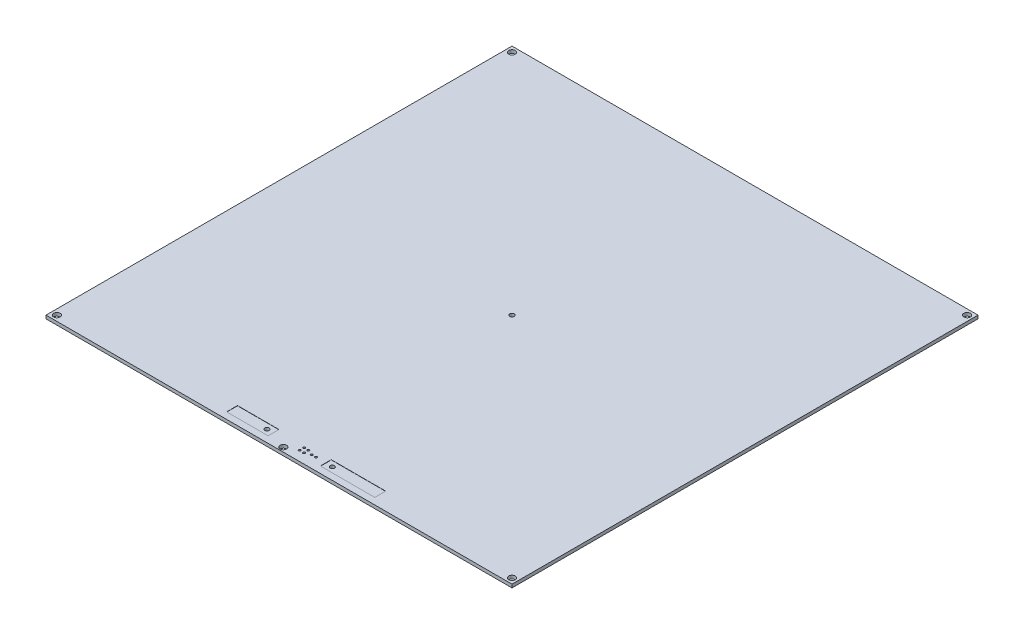
from build123d import *

# Parameters (mm, degrees)
SKIZZE1_W                       = 214
SKIZZE1_H                       = 214
AUFSATZ_LINEAR_AUSTRAGEN1_DEPTH = 1.5
SKIZZE2_R                       = 1.5
SCHNITT_LINEAR_AUSTRAGEN1_DEPTH = 152.328285525
SPIEGELN2_COPY_1_SKETCH_R       = 1.5
SPIEGELN2_COPY_1_DEPTH          = 152.328285525
SKIZZE3_R                       = 1.5
SKIZZE3_R_2                     = 1
SKIZZE3_R_3                     = 0.5
SKIZZE3_R_4                     = 1.05
SCHNITT_LINEAR_AUSTRAGEN2_DEPTH = 152.328285525
SKIZZE4_W                       = 19.050649498
SKIZZE4_H                       = 5
SKIZZE4_W_2                     = 25
SCHNITT_LINEAR_AUSTRAGEN3_DEPTH = 0.1


with BuildPart() as part:
    # Skizze1 → Aufsatz-Linear austragen1 (new body)
    with BuildSketch(Plane(origin=(0, 0, 0), x_dir=(1, 0, 0), z_dir=(0, 1, 0))):
        Rectangle(SKIZZE1_W, SKIZZE1_H)
    extrude(amount=AUFSATZ_LINEAR_AUSTRAGEN1_DEPTH)

    # Skizze2 → Schnitt-Linear austragen1 (cut, through all)
    with BuildSketch(Plane(origin=(0, 1.5, 0), x_dir=(1, 0, 0), z_dir=(0, 1, 0))):
        with Locations(Location((-104.5, 104.5, 0), (0, 0, 270))):
            Circle(SKIZZE2_R)
    schnitt_linear_austragen1 = extrude(amount=-SCHNITT_LINEAR_AUSTRAGEN1_DEPTH, mode=Mode.SUBTRACT)

    # Spiegeln1: Schnitt-Linear austragen1 across plane
    add(schnitt_linear_austragen1.mirror(Plane.XY), mode=Mode.SUBTRACT)

    # Spiegeln2: Schnitt-Linear austragen1 across plane
    add(schnitt_linear_austragen1.mirror(Plane(origin=(0, 0, 0), x_dir=(0, 0, 1), z_dir=(1, 0, 0))), mode=Mode.SUBTRACT)

    # Spiegeln2 copy 1 sketch → Spiegeln2 copy 1 (cut, through all)
    with BuildSketch(Plane(origin=(0, 1.5, 0), x_dir=(-1, 0, 0), z_dir=(0, 1, 0))):
        with Locations(Location((-104.5, 104.5, 0), (0, 0, 270))):
            Circle(SPIEGELN2_COPY_1_SKETCH_R)
    extrude(amount=-SPIEGELN2_COPY_1_DEPTH, mode=Mode.SUBTRACT)

    # Skizze3 → Schnitt-Linear austragen2 (cut, through all)
    with BuildSketch(Plane(origin=(0, 1.5, 0), x_dir=(1, 0, 0), z_dir=(0, 1, 0))):
        with Locations(Location((0, -105, 0), (0, 0, 270))):
            Circle(SKIZZE3_R)
        with Locations(Location((-11, -101.5, 0), (0, 0, 270))):
            Circle(SKIZZE3_R_2)
        with Locations(Location((19, -101.5, 0), (0, 0, 270))):
            Circle(SKIZZE3_R_2)
        with Locations(Location((5, -100.5, 0), (0, 0, 270))):
            Circle(SKIZZE3_R_3)
        with Locations(Location((5, -102.5, 0), (0, 0, 270))):
            Circle(SKIZZE3_R_3)
        with Locations(Location((7, -100.5, 0), (0, 0, 270))):
            Circle(SKIZZE3_R_3)
        with Locations(Location((7, -102.5, 0), (0, 0, 270))):
            Circle(SKIZZE3_R_3)
        with Locations(Location((9.5, -101.5, 0), (0, 0, 270))):
            Circle(SKIZZE3_R_3)
        with Locations(Location((11.5, -101.5, 0), (0, 0, 270))):
            Circle(SKIZZE3_R_3)
        with Locations(Location((0, 0, 0), (0, 0, 270))):
            Circle(SKIZZE3_R_4)
    extrude(amount=-SCHNITT_LINEAR_AUSTRAGEN2_DEPTH, mode=Mode.SUBTRACT)

    # Skizze4 → Schnitt-Linear austragen3 (cut)
    with BuildSketch(Plane(origin=(0, 1.5, 0), x_dir=(1, 0, 0), z_dir=(0, 1, 0))):
        with Locations((-17.525324749, -101.5)):
            Rectangle(SKIZZE4_W, SKIZZE4_H)
        with Locations((28.5, -101.5)):
            Rectangle(SKIZZE4_W_2, SKIZZE4_H)
    extrude(amount=-SCHNITT_LINEAR_AUSTRAGEN3_DEPTH, mode=Mode.SUBTRACT)


solid = part.part
